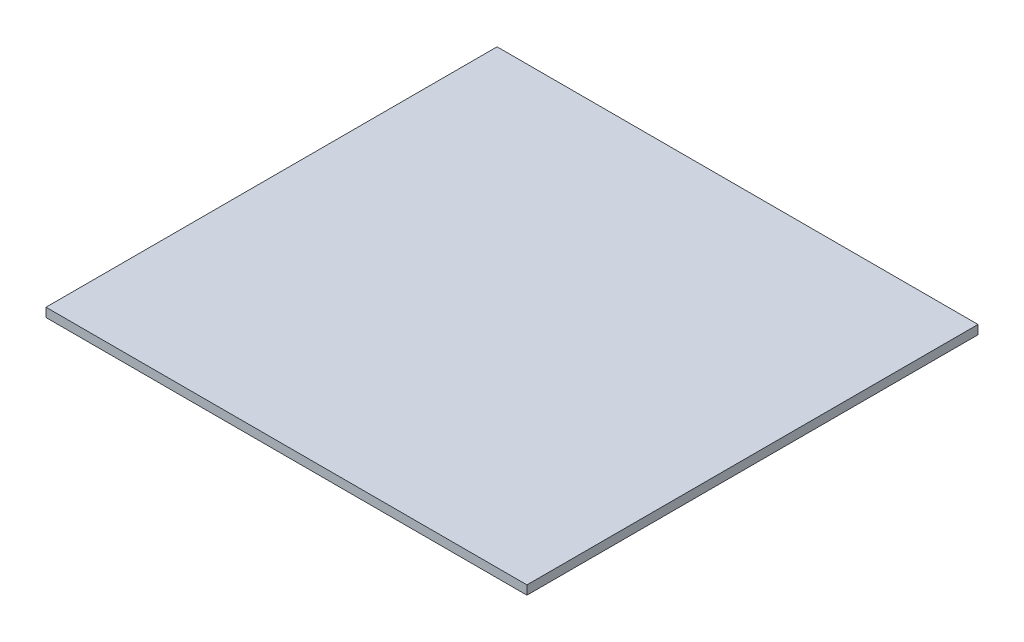
from build123d import *

# Parameters (mm, degrees)
SKETCH1_W           = 161
SKETCH1_H           = 151
BOSS_EXTRUDE1_DEPTH = 3


with BuildPart() as part:
    # Sketch1 → Boss-Extrude1 (new body)
    with BuildSketch(Plane(origin=(0, 0, 0), x_dir=(1, 0, 0), z_dir=(0, 1, 0))):
        with Locations((-35.735981308, 88.70768432)):
            Rectangle(SKETCH1_W, SKETCH1_H)
    extrude(amount=BOSS_EXTRUDE1_DEPTH)


solid = part.part
